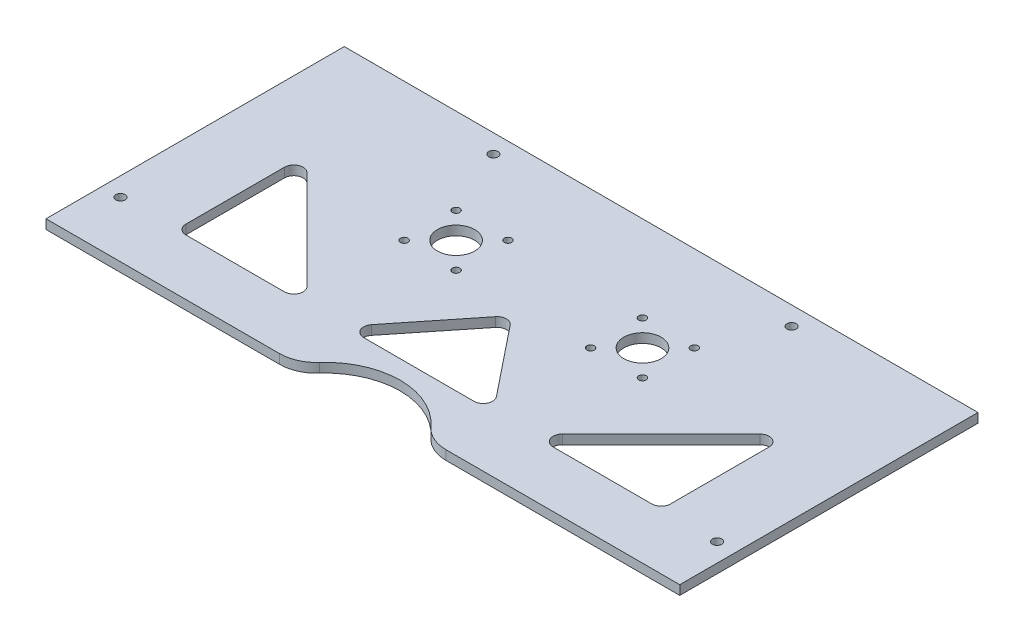
from build123d import *

# Parameters (mm, degrees)
BOSS_EXTRUDE1_DEPTH = 3.175
SKETCH2_R           = 6.35
CUT_EXTRUDE1_DEPTH  = 315.453256661
FILLET1_R           = 12.7
SKETCH3_R           = 1.27
CUT_EXTRUDE2_DEPTH  = 315.453256661
SKETCH4_R           = 1.5875
CUT_EXTRUDE3_DEPTH  = 315.453256661
CUT_EXTRUDE4_DEPTH  = 315.453256661
CUT_EXTRUDE5_DEPTH  = 315.453256661
FILLET2_R           = 3.175


with BuildPart() as part:
    # Sketch1 → Boss-Extrude1 (new body)
    with BuildSketch(Plane(origin=(0, 0, 0), x_dir=(1, 0, 0), z_dir=(0, 1, 0))):
        with BuildLine():
            Line((0, 228.6), (0, 127))
            Line((0, 127), (85.952954744, 127))
            ThreePointArc((85.952954744, 127), (107.95, 139.7), (129.947045256, 127))
            Line((129.947045256, 127), (215.9, 127))
            Line((215.9, 127), (215.9, 228.6))
            Line((215.9, 228.6), (0, 228.6))
        make_face()
    extrude(amount=BOSS_EXTRUDE1_DEPTH)

    # Sketch2 → Cut-Extrude1 (cut, through all)
    with BuildSketch(Plane(origin=(0, 3.175, 0), x_dir=(1, 0, 0), z_dir=(0, 1, 0))):
        with Locations(Location((76.2, 190.5, 0), (0, 0, 270))):
            Circle(SKETCH2_R)
        with Locations(Location((139.7, 190.5, 0), (0, 0, 270))):
            Circle(SKETCH2_R)
    extrude(amount=-CUT_EXTRUDE1_DEPTH, mode=Mode.SUBTRACT)

    # Fillet1
    fillet1_edges = [part.edges().sort_by_distance(p)[0] for p in [
        (85.952954744, 1.5875, -127),
        (129.947045256, 1.5875, -127),
    ]]
    fillet(fillet1_edges, radius=FILLET1_R)

    # Sketch3 → Cut-Extrude2 (cut, through all)
    with BuildSketch(Plane(origin=(0, 3.175, 0), x_dir=(1, 0, 0), z_dir=(0, 1, 0))):
        with Locations(Location((85.038834765, 199.338834765, 0), (0, 0, 270))):
            Circle(SKETCH3_R)
        with Locations(Location((67.361165235, 181.661165235, 0), (0, 0, 270))):
            Circle(SKETCH3_R)
        with Locations(Location((67.361165235, 199.338834765, 0), (0, 0, 270))):
            Circle(SKETCH3_R)
        with Locations(Location((85.038834765, 181.661165235, 0), (0, 0, 270))):
            Circle(SKETCH3_R)
        with Locations(Location((130.861165235, 181.661165235, 0), (0, 0, 270))):
            Circle(SKETCH3_R)
        with Locations(Location((148.538834765, 181.661165235, 0), (0, 0, 270))):
            Circle(SKETCH3_R)
        with Locations(Location((148.538834765, 199.338834765, 0), (0, 0, 270))):
            Circle(SKETCH3_R)
        with Locations(Location((130.861165235, 199.338834765, 0), (0, 0, 270))):
            Circle(SKETCH3_R)
    extrude(amount=-CUT_EXTRUDE2_DEPTH, mode=Mode.SUBTRACT)

    # Sketch4 → Cut-Extrude3 (cut, through all)
    with BuildSketch(Plane(origin=(0, 3.175, 0), x_dir=(1, 0, 0), z_dir=(0, 1, 0))):
        with Locations(Location((6.35, 146.05, 0), (0, 0, 270))):
            Circle(SKETCH4_R)
        with Locations(Location((57.15, 222.25, 0), (0, 0, 270))):
            Circle(SKETCH4_R)
        with Locations(Location((158.75, 222.25, 0), (0, 0, 270))):
            Circle(SKETCH4_R)
        with Locations(Location((209.55, 146.05, 0), (0, 0, 270))):
            Circle(SKETCH4_R)
    extrude(amount=-CUT_EXTRUDE3_DEPTH, mode=Mode.SUBTRACT)

    # Sketch5 → Cut-Extrude4 (cut, through all)
    with BuildSketch(Plane(origin=(0, 3.175, 0), x_dir=(1, 0, 0), z_dir=(0, 1, 0))):
        Polygon((25.4, 190.5), (25.4, 146.05), (69.85, 146.05), align=None)
        Polygon((190.5, 146.05), (146.05, 146.05), (190.5, 190.5), align=None)
    extrude(amount=-CUT_EXTRUDE4_DEPTH, mode=Mode.SUBTRACT)

    # Sketch6 → Cut-Extrude5 (cut, through all)
    with BuildSketch(Plane(origin=(0, 3.175, 0), x_dir=(1, 0, 0), z_dir=(0, 1, 0))):
        Polygon((82.55, 146.05), (133.35, 146.05), (107.95, 177.8), align=None)
    extrude(amount=-CUT_EXTRUDE5_DEPTH, mode=Mode.SUBTRACT)

    # Fillet2
    fillet2_edges = [part.edges().sort_by_distance(p)[0] for p in [
        (25.4, 1.5875, -190.5),
        (69.85, 1.5875, -146.05),
        (25.4, 1.5875, -146.05),
        (190.5, 1.5875, -190.5),
        (190.5, 1.5875, -146.05),
        (146.05, 1.5875, -146.05),
        (82.55, 1.5875, -146.05),
        (107.95, 1.5875, -177.8),
        (133.35, 1.5875, -146.05),
    ]]
    fillet(fillet2_edges, radius=FILLET2_R)


solid = part.part
